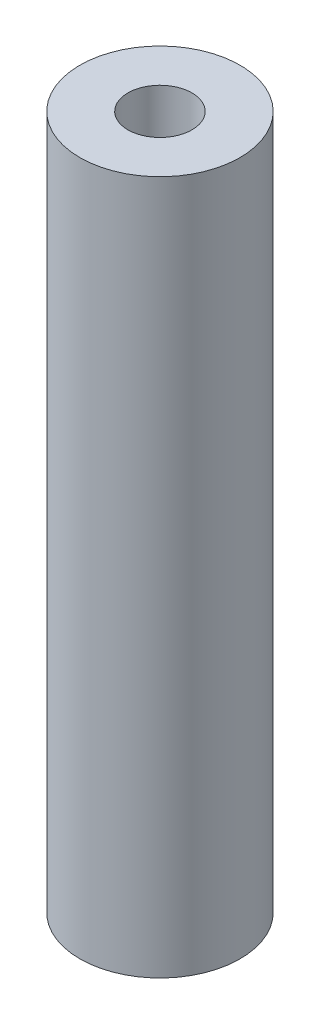
from build123d import *

# Parameters (mm, degrees)
CROQUIS1_R              = 7.5
CROQUIS1_R_2            = 3
SALIENTE_EXTRUIR1_DEPTH = 65


with BuildPart() as part:
    # Croquis1 → Saliente-Extruir1 (new body)
    with BuildSketch(Plane(origin=(0, 0, 0), x_dir=(1, 0, 0), z_dir=(0, 1, 0))):
        with Locations(Location((0, 0, 0), (0, 0, 270))):
            Circle(CROQUIS1_R)
        with Locations(Location((0, 0, 0), (0, 0, 270))):
            Circle(CROQUIS1_R_2, mode=Mode.SUBTRACT)
    extrude(amount=SALIENTE_EXTRUIR1_DEPTH)


solid = part.part
